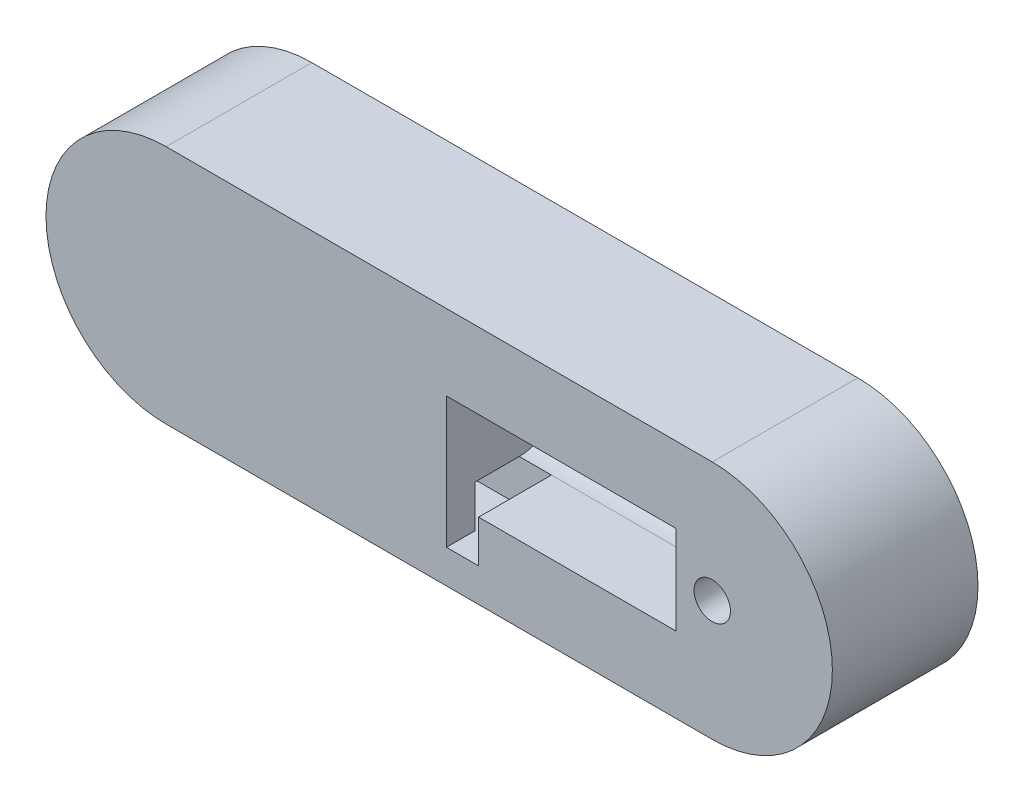
from build123d import *

# Parameters (mm, degrees)
CROQUIS1_R              = 5
SALIENTE_EXTRUIR1_DEPTH = 40
CORTAR_EXTRUIR2_DEPTH   = 10
CORTAR_EXTRUIR4_DEPTH   = 20
CROQUIS6_R              = 12.2
CORTAR_EXTRUIR6_DEPTH   = 63
CORTAR_EXTRUIR9_DEPTH   = 30
CROQUIS8_W              = 12.2
CROQUIS8_H              = 11.6
CORTAR_EXTRUIR10_DEPTH  = 66
CORTAR_EXTRUIR11_REACH  = 151.27
CROQUIS9_W              = 11.6
CROQUIS9_H              = 11.6
CHAFL_N1_SIZE           = 10


with BuildPart() as part:
    # Croquis1 → Saliente-Extruir1 (new body)
    with BuildSketch(Plane.XY):
        with BuildLine():
            Line((106.972889038, 33), (-43.027110962, 33))
            ThreePointArc((-43.027110962, 33), (-76.027110962, 0), (-43.027110962, -33))
            Line((-43.027110962, -33), (106.972889038, -33))
            ThreePointArc((106.972889038, -33), (139.972889038, 0), (106.972889038, 33))
        make_face()
        with Locations((106.972889038, 0)):
            Circle(CROQUIS1_R, mode=Mode.SUBTRACT)
    extrude(amount=SALIENTE_EXTRUIR1_DEPTH)

    # Croquis1<4> → Cortar-Extruir2 (cut)
    with BuildSketch(Plane.XY):
        with BuildLine():
            Line((-41.509889959, -1.303088803), (-41.509889959, 1.303088803))
            ThreePointArc((-41.509889959, 1.303088803), (-45.027110962, 0), (-41.509889959, -1.303088803))
        make_face()
    extrude(amount=CORTAR_EXTRUIR2_DEPTH, mode=Mode.SUBTRACT)

    # Croquis5 → Cortar-Extruir4 (cut)
    with BuildSketch(Plane.XY.offset(40)):
        Polygon((96.972889038, -12.2), (96.972889038, 12.2), (33.972889038, 12.2), (33.972889038, -23.8), (42.805927542, -23.8), (42.805927542, -12.2), align=None)
    extrude(amount=-CORTAR_EXTRUIR4_DEPTH, mode=Mode.SUBTRACT)

    # Croquis6 → Cortar-Extruir6 (cut)
    with BuildSketch(Plane(origin=(33.972889038, 0, 0), x_dir=(0, 0, -1), z_dir=(1, 0, 0))):
        with Locations((-20, 0)):
            Circle(CROQUIS6_R)
        with BuildLine():
            ThreePointArc((-20, -12.2), (-32.2, 0), (-20, 12.2))
            Line((-20, 12.2), (-40, 12.2))
            Line((-40, 12.2), (-40, -12.2))
            Line((-40, -12.2), (-20, -12.2))
        make_face()
    extrude(amount=CORTAR_EXTRUIR6_DEPTH, mode=Mode.SUBTRACT)

    # Croquis7 → Cortar-Extruir9 (cut)
    with BuildSketch(Plane.ZY.offset(-96.972889038)):
        with BuildLine():
            ThreePointArc((7.8, -3.1e-08), (11.37329728, -8.626702741), (20, -12.2))
            Line((20, -12.2), (32.2, -12.2))
            Line((32.2, -12.2), (32.2, 12.2))
            Line((32.2, 12.2), (20, 12.2))
            ThreePointArc((20, 12.2), (11.373297259, 8.62670272), (7.8, -3.1e-08))
        make_face()
        with BuildLine():
            Line((7.8, -12.2), (20, -12.2))
            ThreePointArc((20, -12.2), (11.37329728, -8.626702741), (7.8, -3.1e-08))
            Line((7.8, -3.1e-08), (7.8, -12.2))
        make_face()
        with BuildLine():
            Line((7.8, 12.2), (7.8, -3.1e-08))
            ThreePointArc((7.8, -3.1e-08), (11.373297259, 8.62670272), (20, 12.2))
            Line((20, 12.2), (7.8, 12.2))
        make_face()
    extrude(amount=-CORTAR_EXTRUIR9_DEPTH, mode=Mode.SUBTRACT)

    # Croquis8 → Cortar-Extruir10 (cut)
    with BuildSketch(Plane(origin=(33.972889038, 0, 0), x_dir=(0, 0, -1), z_dir=(1, 0, 0))):
        with Locations((-26.1, -18)):
            Rectangle(CROQUIS8_W, CROQUIS8_H)
    extrude(amount=-CORTAR_EXTRUIR10_DEPTH, mode=Mode.SUBTRACT)

    # Croquis9 → Cortar-Extruir11 (cut, up to next)
    with BuildSketch(Plane(origin=(0, 0, 0), x_dir=(-1, 0, 0), z_dir=(0, 0, -1)), mode=Mode.PRIVATE) as cortar_extruir11_sk1:
        with Locations((26.227110962, -18)):
            Rectangle(CROQUIS9_W, CROQUIS9_H)
    cortar_extruir11_tool1 = extrude(cortar_extruir11_sk1.sketch, amount=-CORTAR_EXTRUIR11_REACH, mode=Mode.PRIVATE) & part.part
    add(cortar_extruir11_tool1.solids().sort_by_distance((-26.227111, -18, 0))[0], mode=Mode.SUBTRACT)

    # Chaflán1
    chafl_n1_edges = [part.edges().sort_by_distance(p)[0] for p in [
        (-32.027110962, -18, 0),
    ]]
    chamfer(chafl_n1_edges, length=CHAFL_N1_SIZE)


solid = part.part
